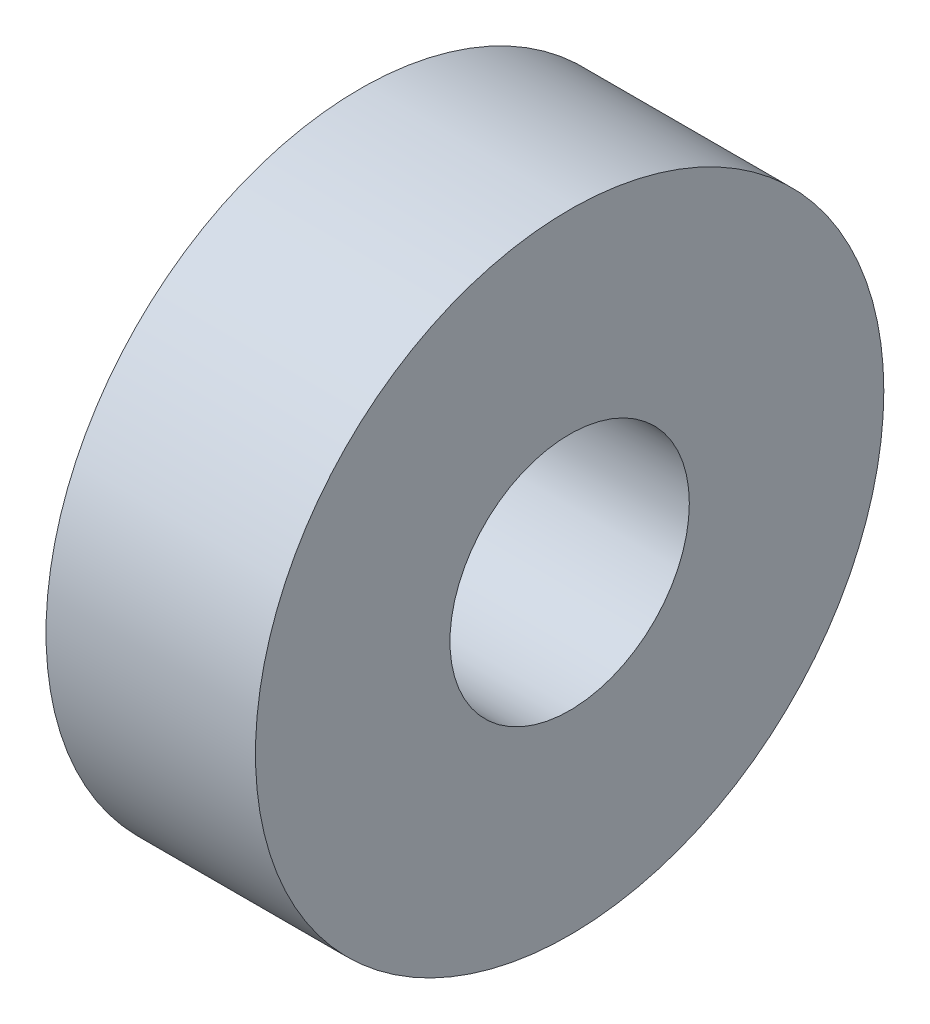
from build123d import *

# Parameters (mm, degrees)
ESBO_O1_R                = 10.5
ESBO_O1_R_2              = 4
RESSALTO_EXTRUS_O1_DEPTH = 7


with BuildPart() as part:
    # Esboço1 → Ressalto-extrusão1 (new body)
    with BuildSketch(Plane(origin=(0, 0, 0), x_dir=(0, 0, -1), z_dir=(1, 0, 0))):
        Circle(ESBO_O1_R)
        Circle(ESBO_O1_R_2, mode=Mode.SUBTRACT)
    extrude(amount=RESSALTO_EXTRUS_O1_DEPTH)


solid = part.part
